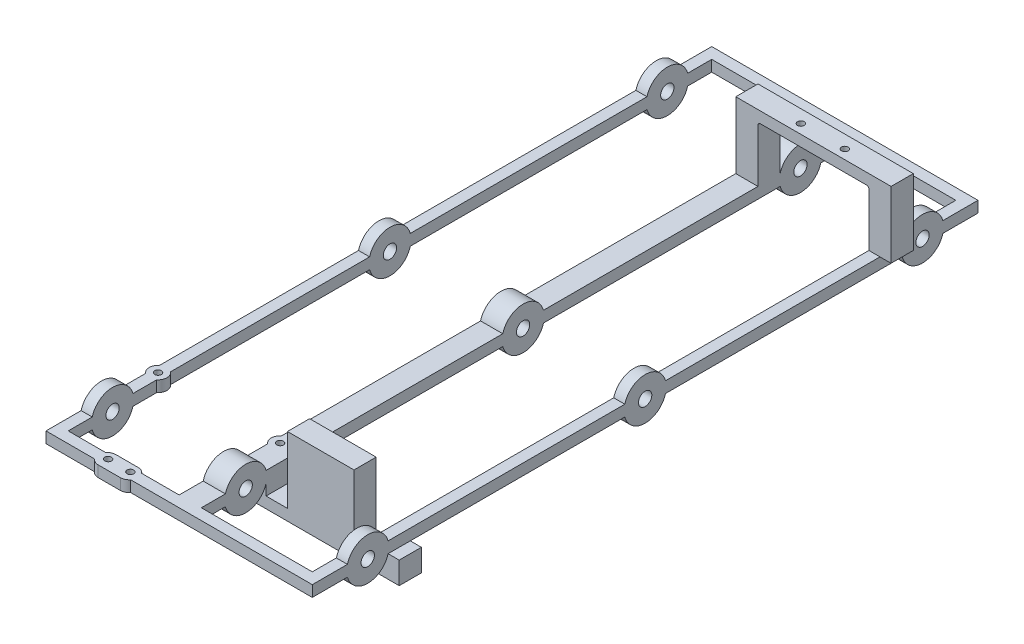
from build123d import *

# Parameters (mm, degrees)
SKETCH2_R               = 3
BOSS_EXTRUDE1_DEPTH     = 180
CUT_EXTRUDE1_DEPTH      = 351.0628515
CUT_EXTRUDE1_DEPTH_BACK = 351.0628515
SKETCH3_W               = 50
SKETCH3_H               = 290
CUT_EXTRUDE2_DEPTH      = 351.0628515
CUT_EXTRUDE2_DEPTH_BACK = 351.0628515
SKETCH4_W               = 102.017694016
SKETCH4_H               = 381.008210697
SKETCH5_W               = 10
SKETCH5_H               = 10
BOSS_EXTRUDE2_DEPTH     = 10
BOSS_EXTRUDE3_REACH     = 309.195
SKETCH6_W               = 10
SKETCH6_H               = 5
SKETCH7_W               = 10
SKETCH7_H               = 10
BOSS_EXTRUDE4_DEPTH     = 30
BOSS_EXTRUDE5_REACH     = 310.95
SKETCH8_W               = 10
SKETCH8_H               = 5
SKETCH9_W               = 30
SKETCH9_H               = 10
BOSS_EXTRUDE6_DEPTH     = 30
FILLET1_R               = 1
CUT_EXTRUDE3_REACH      = 356.718
SKETCH10_R              = 1.5
SKETCH12_R              = 4
BOSS_EXTRUDE7_DEPTH     = 5
SKETCH13_R              = 1.5
CUT_EXTRUDE4_DEPTH      = 355.189214968


with BuildPart() as part:
    # Sketch2 → Boss-Extrude1 (new body)
    with BuildSketch(Plane(origin=(0, 0, 0), x_dir=(0, 0, -1), z_dir=(1, 0, 0))):
        with BuildLine():
            Line((159.16515139, 5), (265.83484861, 5))
            ThreePointArc((265.83484861, 5), (275, 12), (284.16515139, 5))
            Line((284.16515139, 5), (300, 5))
            Line((300, 5), (300, 0))
            Line((300, 0), (284.16515139, 0))
            ThreePointArc((284.16515139, 0), (275, -7), (265.83484861, 0))
            Line((265.83484861, 0), (159.16515139, 0))
            ThreePointArc((159.16515139, 0), (150, -7), (140.83484861, 0))
            Line((140.83484861, 0), (34.16515139, 0))
            ThreePointArc((34.16515139, 0), (25, -7), (15.83484861, 0))
            Line((15.83484861, 0), (0, 0))
            Line((0, 0), (0, 5))
            Line((0, 5), (15.83484861, 5))
            ThreePointArc((15.83484861, 5), (25, 12), (34.16515139, 5))
            Line((34.16515139, 5), (140.83484861, 5))
            ThreePointArc((140.83484861, 5), (150, 12), (159.16515139, 5))
        make_face()
        with Locations(Location((150, 2.5, 0), (0, 0, 180))):
            Circle(SKETCH2_R, mode=Mode.SUBTRACT)
        with Locations(Location((275, 2.5, 0), (0, 0, 180))):
            Circle(SKETCH2_R, mode=Mode.SUBTRACT)
        with Locations(Location((25, 2.5, 0), (0, 0, 180))):
            Circle(SKETCH2_R, mode=Mode.SUBTRACT)
    extrude(amount=BOSS_EXTRUDE1_DEPTH)

    # Sketch3 → Cut-Extrude1 (cut, two sides: drawn at the far end of the back side and taken through both)
    with BuildSketch(Plane(origin=(0, 5, 0), x_dir=(1, 0, 0), z_dir=(0, 1, 0)).offset(-CUT_EXTRUDE1_DEPTH_BACK)):
        with Locations((150, 150)):
            Rectangle(SKETCH3_W, SKETCH3_H)
        with Locations((90, 150)):
            Rectangle(SKETCH3_W, SKETCH3_H)
        with Locations((30, 150)):
            Rectangle(SKETCH3_W, SKETCH3_H)
    extrude(amount=CUT_EXTRUDE1_DEPTH + CUT_EXTRUDE1_DEPTH_BACK, mode=Mode.SUBTRACT)

    # Sketch4 → Cut-Extrude2 (cut, two sides: drawn at the far end of the back side and taken through both)
    with BuildSketch(Plane(origin=(0, 5, 0), x_dir=(1, 0, 0), z_dir=(0, 1, 0)).offset(-CUT_EXTRUDE2_DEPTH_BACK)):
        with Locations((8.991152992, 132.065308574)):
            Rectangle(SKETCH4_W, SKETCH4_H)
    extrude(amount=CUT_EXTRUDE2_DEPTH + CUT_EXTRUDE2_DEPTH_BACK, mode=Mode.SUBTRACT)

    # Sketch5 → Boss-Extrude2 (add)
    with BuildSketch(Plane.XZ):
        with Locations((120, -39.16515139)):
            Rectangle(SKETCH5_W, SKETCH5_H)
        with Locations((180, -39.16515139)):
            Rectangle(SKETCH5_W, SKETCH5_H)
    extrude(amount=BOSS_EXTRUDE2_DEPTH)

    # Sketch6 → Boss-Extrude3 (add, up to next)
    with BuildSketch(Plane(origin=(125, 0, 0), x_dir=(0, 0, -1), z_dir=(1, 0, 0)), mode=Mode.PRIVATE) as boss_extrude3_sk1:
        with Locations((39.16515139, -7.5)):
            Rectangle(SKETCH6_W, SKETCH6_H)
    boss_extrude3_tool1 = extrude(boss_extrude3_sk1.sketch, amount=BOSS_EXTRUDE3_REACH, mode=Mode.PRIVATE) - part.part
    add(boss_extrude3_tool1.solids().sort_by_distance((125, -7.5, -39.165151))[0])

    # Sketch7 → Boss-Extrude4 (add)
    with BuildSketch(Plane(origin=(0, 5, 0), x_dir=(1, 0, 0), z_dir=(0, 1, 0))):
        with Locations((120, 260.83484861)):
            Rectangle(SKETCH7_W, SKETCH7_H)
        with Locations((180, 260.83484861)):
            Rectangle(SKETCH7_W, SKETCH7_H)
    extrude(amount=BOSS_EXTRUDE4_DEPTH)

    # Sketch8 → Boss-Extrude5 (add, up to next)
    with BuildSketch(Plane(origin=(125, 0, 0), x_dir=(0, 0, -1), z_dir=(1, 0, 0)), mode=Mode.PRIVATE) as boss_extrude5_sk1:
        with Locations((260.83484861, 32.5)):
            Rectangle(SKETCH8_W, SKETCH8_H)
    boss_extrude5_tool1 = extrude(boss_extrude5_sk1.sketch, amount=BOSS_EXTRUDE5_REACH, mode=Mode.PRIVATE) - part.part
    add(boss_extrude5_tool1.solids().sort_by_distance((125, 32.5, -260.834849))[0])

    # Sketch9 → Boss-Extrude6 (add)
    with BuildSketch(Plane(origin=(0, -5, 0), x_dir=(1, 0, 0), z_dir=(0, 1, 0))):
        with Locations((149.626726127, 39.16515139)):
            Rectangle(SKETCH9_W, SKETCH9_H)
    extrude(amount=BOSS_EXTRUDE6_DEPTH)

    # Fillet1
    fillet1_edges = [part.edges().sort_by_distance(p)[0] for p in [
        (175, 30, -260.83484861),
        (125, 30, -260.83484861),
    ]]
    fillet(fillet1_edges, radius=FILLET1_R)

    # Sketch10 → Cut-Extrude3 (cut, up to next)
    with BuildSketch(Plane.XZ.offset(-30), mode=Mode.PRIVATE) as cut_extrude3_sk1:
        with Locations(Location((159.960341314, -260.025208151, 0), (0, 0, 270))):
            Circle(SKETCH10_R)
    cut_extrude3_tool1 = extrude(cut_extrude3_sk1.sketch, amount=-CUT_EXTRUDE3_REACH, mode=Mode.PRIVATE) & part.part
    # Sketch10 → Cut-Extrude3 (cut, up to next)
    with BuildSketch(Plane.XZ.offset(-30), mode=Mode.PRIVATE) as cut_extrude3_sk2:
        with Locations(Location((140.127008814, -260.025208151, 0), (0, 0, 270))):
            Circle(SKETCH10_R)
    cut_extrude3_tool2 = extrude(cut_extrude3_sk2.sketch, amount=-CUT_EXTRUDE3_REACH, mode=Mode.PRIVATE) & part.part
    add(cut_extrude3_tool1.solids().sort_by_distance((159.960341, 30, -260.025208))[0], mode=Mode.SUBTRACT)
    add(cut_extrude3_tool2.solids().sort_by_distance((140.127009, 30, -260.025208))[0], mode=Mode.SUBTRACT)

    # Sketch12 → Boss-Extrude7 (add)
    with BuildSketch(Plane(origin=(0, 0, 0), x_dir=(-1, 0, 0), z_dir=(0, -1, 0))):
        with Locations((-62.5, 48)):
            Circle(SKETCH12_R)
        with Locations((-117.5, 48)):
            Circle(SKETCH12_R)
        with BuildLine():
            Line((-85, -1.5), (-95, -1.5))
            ThreePointArc((-95, -1.5), (-99, 2.5), (-95, 6.5))
            Line((-95, 6.5), (-85, 6.5))
            ThreePointArc((-85, 6.5), (-81, 2.5), (-85, -1.5))
        make_face()
    extrude(amount=-BOSS_EXTRUDE7_DEPTH)

    # Sketch13 → Cut-Extrude4 (cut, through all)
    with BuildSketch(Plane(origin=(0, 0, 0), x_dir=(-1, 0, 0), z_dir=(0, -1, 0))):
        with Locations(Location((-62.5, 48, 0), (0, 0, 90))):
            Circle(SKETCH13_R)
        with Locations(Location((-85, 3, 0), (0, 0, 90))):
            Circle(SKETCH13_R)
        with Locations(Location((-95, 3, 0), (0, 0, 90))):
            Circle(SKETCH13_R)
        with Locations(Location((-117.5, 48, 0), (0, 0, 90))):
            Circle(SKETCH13_R)
    extrude(amount=-CUT_EXTRUDE4_DEPTH, mode=Mode.SUBTRACT)


solid = part.part
